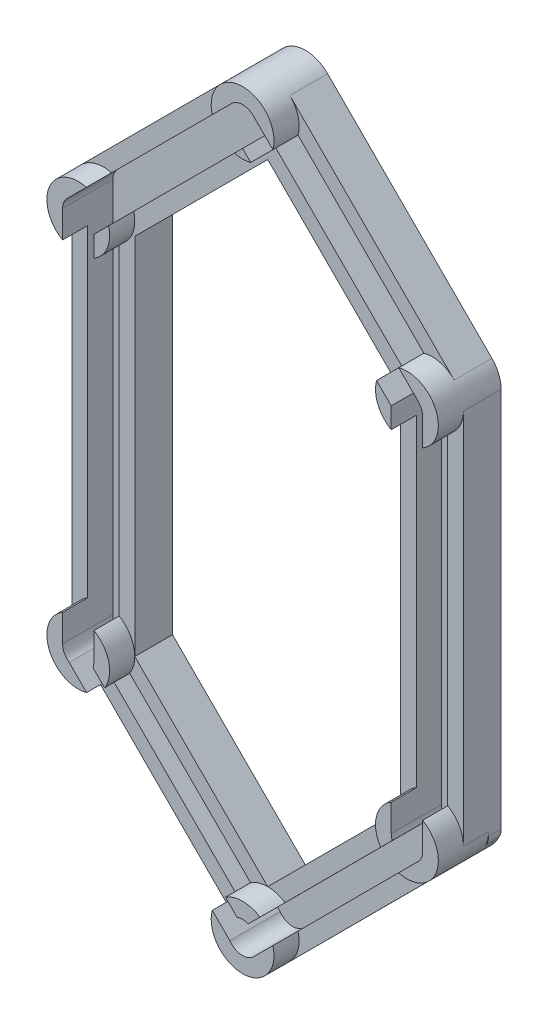
from build123d import *
from build123d.topology import SkipClean

# Parameters (mm, degrees)
SKETCH_1_R                      = 5
SKETCH_1_R_2                    = 2.5
EXTRUDE_1_DEPTH                 = 10
EXTRUDE_1_2_DEPTH               = 10
EXTRUDE_1_3_DEPTH               = 10
EXTRUDE_1_4_DEPTH               = 10
EXTRUDE_1_5_DEPTH               = 10
EXTRUDE_1_6_DEPTH               = 10
EXTRUDE_2_DEPTH                 = 6
EXTRUDE_4_DEPTH                 = 6
CUT_EXTRUDE_1_DEPTH             = 4
SKETCH_5_R                      = 3.75
SKETCH_5_R_2                    = 2.5
EXTRUDE_3_DEPTH                 = 2
CUT_EXTRUDE_2_DEPTH             = 4
CUT_EXTRUDE_3_DEPTH             = 8
SKETCH_11_R                     = 2.5
EXTRUDE_9_DEPTH                 = 2
AUFSATZ_LINEAR_AUSTRAGEN1_DEPTH = 6
SKIZZE4_W                       = 5
SKIZZE4_H                       = 59.806963929
SCHNITT_LINEAR_AUSTRAGEN1_DEPTH = 8
SCHNITT_LINEAR_AUSTRAGEN2_DEPTH = 8
SCHNITT_LINEAR_AUSTRAGEN3_DEPTH = 8
SCHNITT_LINEAR_AUSTRAGEN6_DEPTH = 8
SCHNITT_LINEAR_START            = -4
SCHNITT_LINEAR_AUSTRAGEN7_DEPTH = 4


with BuildPart() as part:
    # Эскиз1 → Бобышка-Вытянуть1 (new body)
    with BuildSketch(Plane.XY):
        with Locations((-12.085916667, 4.294857344)):
            Circle(SKETCH_1_R)
        with Locations((-12.085916667, 4.294857344)):
            Circle(SKETCH_1_R_2, mode=Mode.SUBTRACT)
    extrude(amount=EXTRUDE_1_DEPTH)



with BuildPart() as body_2:
    # Эскиз1 → Extrude 1 2 (new body)
    with BuildSketch(Plane.XY):
        with Locations((-38.24886757, -21.86809356)):
            Circle(SKETCH_1_R)
        with Locations((-38.24886757, -21.86809356)):
            Circle(SKETCH_1_R_2, mode=Mode.SUBTRACT)
    extrude(amount=EXTRUDE_1_2_DEPTH)


with BuildPart() as body_3:
    # Эскиз1 → Extrude 1 3 (new body)
    with BuildSketch(Plane.XY):
        with Locations((14.077034237, -21.86809356)):
            Circle(SKETCH_1_R)
        with Locations((14.077034237, -21.86809356)):
            Circle(SKETCH_1_R_2, mode=Mode.SUBTRACT)
    extrude(amount=EXTRUDE_1_3_DEPTH)


with BuildPart() as body_4:
    # Эскиз1 → Extrude 1 4 (new body)
    with BuildSketch(Plane.XY):
        with Locations((-38.24886757, -81.86809356)):
            Circle(SKETCH_1_R)
        with Locations((-38.24886757, -81.86809356)):
            Circle(SKETCH_1_R_2, mode=Mode.SUBTRACT)
    extrude(amount=EXTRUDE_1_4_DEPTH)


with BuildPart() as body_5:
    # Эскиз1 → Extrude 1 5 (new body)
    with BuildSketch(Plane.XY):
        with Locations((14.077034237, -81.86809356)):
            Circle(SKETCH_1_R)
        with Locations((14.077034237, -81.86809356)):
            Circle(SKETCH_1_R_2, mode=Mode.SUBTRACT)
    extrude(amount=EXTRUDE_1_5_DEPTH)


with BuildPart() as body_6:
    # Эскиз1 → Extrude 1 6 (new body)
    with BuildSketch(Plane.XY):
        with Locations((-12.085916667, -108.031044464)):
            Circle(SKETCH_1_R)
        with Locations((-12.085916667, -108.031044464)):
            Circle(SKETCH_1_R_2, mode=Mode.SUBTRACT)
    extrude(amount=EXTRUDE_1_6_DEPTH)


with BuildPart() as part_1:
    add(part.part)

    add(body_2.part)  # Бобышка-Вытянуть2 merges body 2
    # Эскиз3 → Бобышка-Вытянуть2 (add)
    with BuildSketch(Plane(origin=(0, 0, 0), x_dir=(-1, 0, 0), z_dir=(0, 0, -1))):
        Polygon((12.085916667, 4.294857344), (15.621450572, 7.83039125), (41.784401476, -18.332559654), (34.713333665, -25.403627466), (8.550382761, 0.759323438), align=None)
    extrude(amount=-EXTRUDE_2_DEPTH)


    add(body_3.part)  # Бобышка-Вытянуть4 merges body 3
    # Эскиз9 → Бобышка-Вытянуть4 (add)
    with BuildSketch(Plane(origin=(0, 0, 0), x_dir=(-1, 0, 0), z_dir=(0, 0, -1))):
        Polygon((-14.077034237, -21.86809356), (-17.612568143, -18.332559654), (8.550382761, 7.83039125), (15.621450572, 0.759323438), (-10.541500331, -25.403627466), align=None)
    extrude(amount=-EXTRUDE_4_DEPTH)

    # Эскиз4 → Вырез-Вытянуть1 (cut)
    with BuildSketch(Plane.XY.offset(6)):
        Polygon((-13.85368362, 6.062624297), (-10.318149714, 2.527090391), (-36.481100617, -23.635860513), (-40.016634523, -20.100326607), align=None)
    extrude(amount=-CUT_EXTRUDE_1_DEPTH, mode=Mode.SUBTRACT)

    # Эскиз5 → Бобышка-Вытянуть3 (add)
    with BuildSketch(Plane(origin=(0, 0, 0), x_dir=(-1, 0, 0), z_dir=(0, 0, -1))):
        with Locations((12.969800143, 5.178740821)):
            Circle(SKETCH_5_R)
        with Locations((38.24886757, -21.86809356)):
            Circle(SKETCH_5_R_2)
    extrude(amount=-EXTRUDE_3_DEPTH)

    # Эскиз4<2> → Вырез-Вытянуть2 (cut)
    with BuildSketch(Plane.XY.offset(6)):
        Polygon((-13.85368362, 6.062624297), (-10.318149714, 2.527090391), (-36.481100617, -23.635860513), (-40.016634523, -20.100326607), align=None)
    extrude(amount=CUT_EXTRUDE_2_DEPTH, mode=Mode.SUBTRACT)

    # Эскиз10 → Вырез-Вытянуть3 (cut)
    with BuildSketch(Plane.XY.offset(10)):
        Polygon((14.077034237, -21.86809356), (12.309267284, -23.635860513), (-13.85368362, 2.527090391), (-12.085916667, 4.294857344), (-10.318149714, 6.062624297), (15.84480119, -20.100326607), align=None)
    extrude(amount=-CUT_EXTRUDE_3_DEPTH, mode=Mode.SUBTRACT)

    # Эскиз11 → Бобышка-Вытянуть9 (add)
    with BuildSketch(Plane(origin=(0, 0, 0), x_dir=(-1, 0, 0), z_dir=(0, 0, -1))):
        with Locations((-14.077034237, -21.86809356)):
            Circle(SKETCH_11_R)
    extrude(amount=-EXTRUDE_9_DEPTH)


    add(body_4.part)  # Aufsatz-Linear austragen1 merges body 4

    add(body_5.part)  # Aufsatz-Linear austragen1 merges body 5

    add(body_6.part)  # Aufsatz-Linear austragen1 merges body 6
    # Skizze2 → Aufsatz-Linear austragen1 (add)
    with BuildSketch(Plane(origin=(0, 0, 0), x_dir=(-1, 0, 0), z_dir=(0, 0, -1))):
        with BuildLine():
            Line((-19.077034237, -21.86809356), (-19.077034237, -82.509912102))
            ThreePointArc((-19.077034237, -82.509912102), (-18.955201687, -83.290446679), (-18.601294786, -83.996723751))
            Line((-18.601294786, -83.996723751), (-17.963462032, -85.013833377))
            Line((-17.963462032, -85.013833377), (8.547769183, -111.563962859))
            Line((8.547769183, -111.563962859), (15.62406415, -111.563962859))
            Line((15.62406415, -111.563962859), (41.784377989, -85.403650953))
            Line((41.784377989, -85.403650953), (43.24886757, -81.86809356))
            Line((43.24886757, -81.86809356), (43.24886757, -21.86809356))
            Line((43.24886757, -21.86809356), (33.24886757, -23.939161372))
            Line((33.24886757, -23.939161372), (33.24886757, -81.86809356))
            Line((33.24886757, -81.86809356), (12.085916667, -103.031044464))
            Line((12.085916667, -103.031044464), (-9.077034237, -81.86809356))
            Line((-9.077034237, -81.86809356), (-9.077034237, -23.939161372))
            Line((-9.077034237, -23.939161372), (-19.077034237, -21.86809356))
        make_face()
    extrude(amount=-AUFSATZ_LINEAR_AUSTRAGEN1_DEPTH)

    # Skizze4 → Schnitt-Linear austragen1 (cut)
    with SkipClean():  # the faces are left unmerged after this step: merging them gives an invalid solid
        with BuildSketch(Plane.XY.offset(10)):
            with Locations((14.077034237, -51.964611596)):
                Rectangle(SKIZZE4_W, SKIZZE4_H)
        extrude(amount=-SCHNITT_LINEAR_AUSTRAGEN1_DEPTH, mode=Mode.SUBTRACT)

    # Skizze5 → Schnitt-Linear austragen2 (cut)
    with SkipClean():  # the faces are left unmerged after this step: merging them gives an invalid solid
        with BuildSketch(Plane.XY.offset(10)):
            Polygon((-38.24886757, -81.86809356), (-35.74886757, -81.86809356), (-35.74886757, -21.86809356), (-40.74886757, -21.86809356), (-40.74886757, -81.86809356), align=None)
        extrude(amount=-SCHNITT_LINEAR_AUSTRAGEN2_DEPTH, mode=Mode.SUBTRACT)

    # Skizze6 → Schnitt-Linear austragen3 (cut)
    with SkipClean():  # the faces are left unmerged after this step: merging them gives an invalid solid
        with BuildSketch(Plane.XY.offset(10)):
            Polygon((-12.815807368, -107.346754652), (13.705977842, -80.78605569), (16.182665193, -83.259114477), (-10.339120017, -109.819813439), align=None)
        extrude(amount=-SCHNITT_LINEAR_AUSTRAGEN3_DEPTH, mode=Mode.SUBTRACT)

    # Skizze8 → Schnitt-Linear austragen6 (cut)
    with SkipClean():  # the faces are left unmerged after this step: merging them gives an invalid solid
        with BuildSketch(Plane.XY.offset(10)):
            Polygon((-37.36882645, -81.283668587), (-11.186213036, -107.466282), (-13.66108677, -109.941155734), (-39.843700184, -83.758542321), align=None)
        extrude(amount=-SCHNITT_LINEAR_AUSTRAGEN6_DEPTH, mode=Mode.SUBTRACT)

    # Skizze10 → Schnitt-Linear austragen7 (cut)
    with SkipClean():  # the faces are left unmerged after this step: merging them gives an invalid solid
        with BuildSketch(Plane.XY.offset(6).offset(SCHNITT_LINEAR_START)):
            with BuildLine():
                Line((-11.940605405, -108.220674369), (-13.66108677, -109.941155734))
                Line((-13.66108677, -109.941155734), (-14.125547986, -109.476694519))
                ThreePointArc((-14.125547986, -109.476694519), (-12.311454238, -110.52085024), (-10.339260555, -109.819673108))
                Line((-10.339260555, -109.819673108), (-11.940605405, -108.220674369))
            make_face()
            with BuildLine():
                Line((-12.962669252, -105.689825784), (-12.061327377, -106.591167659))
                Line((-12.061327377, -106.591167659), (-11.174544611, -105.703083773))
                ThreePointArc((-11.174544611, -105.703083773), (-12.067381012, -105.531113179), (-12.962669252, -105.689825784))
            make_face()
            with BuildLine():
                Line((-39.843700184, -83.758542321), (-37.953251423, -81.86809356))
                Line((-37.953251423, -81.86809356), (-40.74886757, -81.86809356))
                ThreePointArc((-40.74886757, -81.86809356), (-40.46969232, -83.01610812), (-39.694517625, -83.907724879))
                Line((-39.694517625, -83.907724879), (-39.843700184, -83.758542321))
            make_face()
            with BuildLine():
                Line((-36.784401476, -81.86809356), (-35.907648891, -82.744846145))
                ThreePointArc((-35.907648891, -82.744846145), (-35.78888315, -82.313600744), (-35.74886757, -81.86809356))
                Line((-35.74886757, -81.86809356), (-36.784401476, -81.86809356))
            make_face()
            with BuildLine():
                Line((14.789603319, -81.86809356), (16.165610117, -83.242084387))
                ThreePointArc((16.165610117, -83.242084387), (16.471970531, -82.585226846), (16.577034237, -81.86809356))
                Line((16.577034237, -81.86809356), (14.789603319, -81.86809356))
            make_face()
            with BuildLine():
                Line((11.739718918, -82.755199583), (12.625525252, -81.86809356))
                Line((12.625525252, -81.86809356), (11.577034237, -81.86809356))
                ThreePointArc((11.577034237, -81.86809356), (11.61804173, -82.319043502), (11.739718918, -82.755199583))
            make_face()
            with BuildLine():
                Line((19.077034237, -82.509912102), (19.077034237, -81.86809356))
                ThreePointArc((19.077034237, -81.86809356), (18.956650141, -82.958666175), (18.601294786, -83.996723751))
                ThreePointArc((18.601294786, -83.996723751), (18.955201687, -83.290446679), (19.077034237, -82.509912102))
            make_face()
        extrude(amount=SCHNITT_LINEAR_AUSTRAGEN7_DEPTH, mode=Mode.SUBTRACT)


solid = part_1.part
